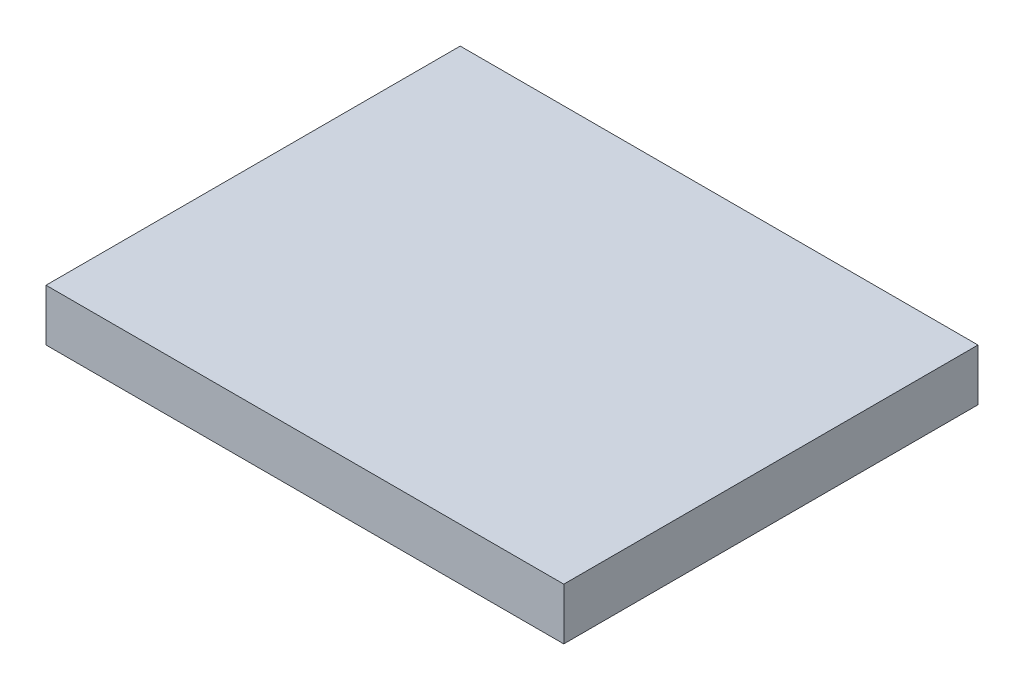
from build123d import *

# Parameters (mm, degrees)
SKETCH1_W           = 50
SKETCH1_H           = 40
BOSS_EXTRUDE1_DEPTH = 2.5


with BuildPart() as part:
    # Sketch1 → Boss-Extrude1 (new, symmetric)
    with BuildSketch(Plane(origin=(0, 0, 0), x_dir=(1, 0, 0), z_dir=(0, 1, 0))):
        Rectangle(SKETCH1_W, SKETCH1_H)
    extrude(amount=BOSS_EXTRUDE1_DEPTH, both=True)


solid = part.part
